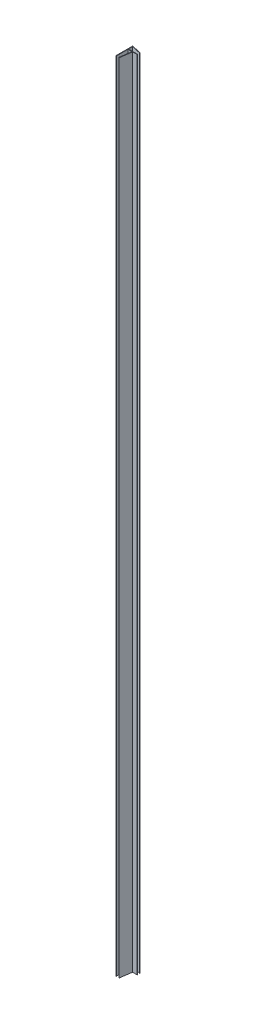
from build123d import *

# Parameters (mm, degrees)
BOSS_EXTRUDE1_DEPTH = 2080.72


with BuildPart() as part:
    # Sketch1 → Boss-Extrude1 (new body)
    with BuildSketch(Plane(origin=(0, 0, 0), x_dir=(1, 0, 0), z_dir=(0, 1, 0))):
        Polygon((-13.2, 22.019642185), (-13.2, -22), (-12, -22), (-12, 8.525730065), (-1.2, 8.525730065), (-5.5, -22), (-4.288152752, -22), (0.011847248, 8.525730065), (12, 8.525730065), (12, 9.725730065), (-12, 9.725730065), (-12, 20.525730065), (12, 15.225730065), (12, 16.454642185), align=None)
    extrude(amount=BOSS_EXTRUDE1_DEPTH)


solid = part.part
